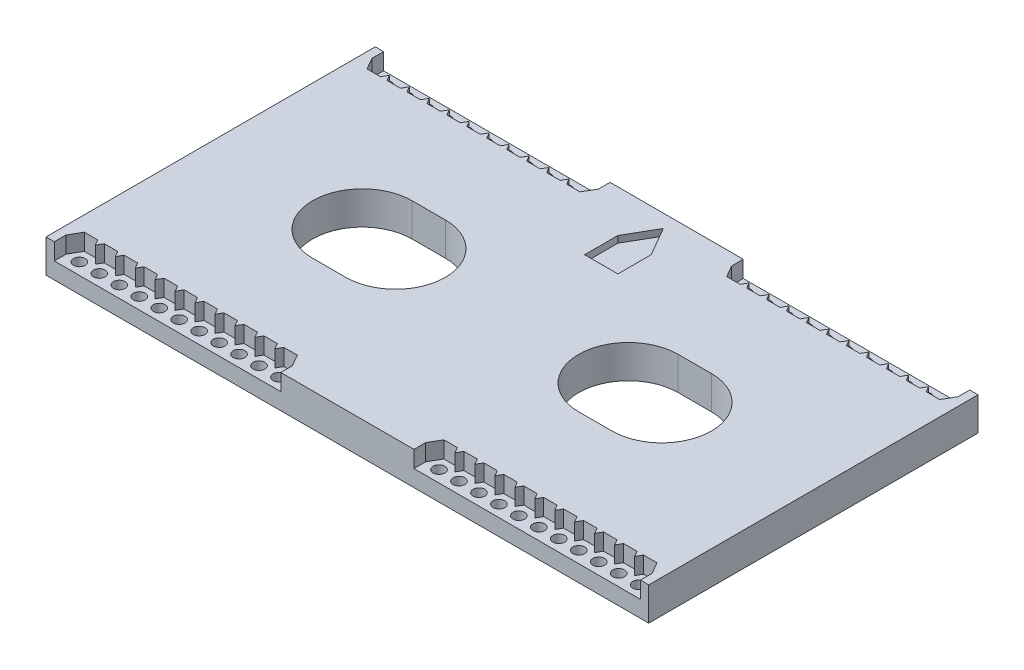
from build123d import *

# Parameters (mm, degrees)
SKETCH1_R           = 2.2479
BOSS_EXTRUDE1_DEPTH = 12.6625
SKETCH1_5_R         = 2.2479
CUT_EXTRUDE1_DEPTH  = 6.35
CUT_EXTRUDE3_DEPTH  = 2.54


with BuildPart() as part:
    # Sketch1 → Boss-Extrude1 (new body)
    with BuildSketch(Plane(origin=(0, 0, 0), x_dir=(1, 0, 0), z_dir=(0, 1, 0))):
        with BuildLine():
            Line((-8.303977719, 62.861825), (-8.303977719, 0))
            Line((-8.303977719, 0), (30.609375, 0))
            ThreePointArc((30.609375, 0), (36.174346157, 13.435028843), (49.609375, 19))
            Line((49.609375, 19), (62.309375, 19))
            ThreePointArc((62.309375, 19), (75.744403843, 13.435028843), (81.309375, 0))
            Line((81.309375, 0), (106.759375, 0))
            Line((106.759375, 0), (106.759375, 62.861825))
            Line((106.759375, 62.861825), (-8.303977719, 62.861825))
        make_face()
        with Locations((0, 58.42)):
            Circle(SKETCH1_R, mode=Mode.SUBTRACT)
        with Locations((7.62, 58.42)):
            Circle(SKETCH1_R, mode=Mode.SUBTRACT)
        with Locations((15.24, 58.42)):
            Circle(SKETCH1_R, mode=Mode.SUBTRACT)
        with Locations((22.86, 58.42)):
            Circle(SKETCH1_R, mode=Mode.SUBTRACT)
        with Locations((30.48, 58.42)):
            Circle(SKETCH1_R, mode=Mode.SUBTRACT)
        with Locations((38.1, 58.42)):
            Circle(SKETCH1_R, mode=Mode.SUBTRACT)
        with Locations((45.72, 58.42)):
            Circle(SKETCH1_R, mode=Mode.SUBTRACT)
        with Locations((53.34, 58.42)):
            Circle(SKETCH1_R, mode=Mode.SUBTRACT)
        with Locations((60.96, 58.42)):
            Circle(SKETCH1_R, mode=Mode.SUBTRACT)
        with Locations((68.58, 58.42)):
            Circle(SKETCH1_R, mode=Mode.SUBTRACT)
        with Locations((76.2, 58.42)):
            Circle(SKETCH1_R, mode=Mode.SUBTRACT)
    extrude(amount=-BOSS_EXTRUDE1_DEPTH)

    # Sketch1<5> → Cut-Extrude1 (cut)
    with BuildSketch(Plane(origin=(0, 0, 0), x_dir=(1, 0, 0), z_dir=(0, 1, 0))):
        Polygon((78.764488859, 53.978175), (80.01, 56.135463577), (81.328977719, 58.42), (81.328977719, 62.861825), (-5.128977719, 62.861825), (-5.128977719, 58.42), (-3.846733289, 56.1990875), (-3.81, 56.135463577), (-2.564488859, 53.978175), (2.564488859, 53.978175), (3.81, 56.135463577), (5.055511141, 53.978175), (10.184488859, 53.978175), (11.43, 56.135463577), (12.675511141, 53.978175), (17.804488859, 53.978175), (19.05, 56.135463577), (20.295511141, 53.978175), (25.424488859, 53.978175), (26.67, 56.135463577), (27.915511141, 53.978175), (33.044488859, 53.978175), (34.29, 56.135463577), (35.535511141, 53.978175), (40.664488859, 53.978175), (41.91, 56.135463577), (43.155511141, 53.978175), (48.284488859, 53.978175), (49.53, 56.135463577), (50.775511141, 53.978175), (55.904488859, 53.978175), (57.15, 56.135463577), (58.395511141, 53.978175), (63.524488859, 53.978175), (64.77, 56.135463577), (66.015511141, 53.978175), (71.144488859, 53.978175), (72.39, 56.135463577), (73.635511141, 53.978175), align=None)
        with Locations((0, 58.42)):
            Circle(SKETCH1_5_R, mode=Mode.SUBTRACT)
        with Locations((7.62, 58.42)):
            Circle(SKETCH1_5_R, mode=Mode.SUBTRACT)
        with Locations((15.24, 58.42)):
            Circle(SKETCH1_5_R, mode=Mode.SUBTRACT)
        with Locations((22.86, 58.42)):
            Circle(SKETCH1_5_R, mode=Mode.SUBTRACT)
        with Locations((30.48, 58.42)):
            Circle(SKETCH1_5_R, mode=Mode.SUBTRACT)
        with Locations((38.1, 58.42)):
            Circle(SKETCH1_5_R, mode=Mode.SUBTRACT)
        with Locations((45.72, 58.42)):
            Circle(SKETCH1_5_R, mode=Mode.SUBTRACT)
        with Locations((53.34, 58.42)):
            Circle(SKETCH1_5_R, mode=Mode.SUBTRACT)
        with Locations((60.96, 58.42)):
            Circle(SKETCH1_5_R, mode=Mode.SUBTRACT)
        with Locations((68.58, 58.42)):
            Circle(SKETCH1_5_R, mode=Mode.SUBTRACT)
        with Locations((76.2, 58.42)):
            Circle(SKETCH1_5_R, mode=Mode.SUBTRACT)
    extrude(amount=-CUT_EXTRUDE1_DEPTH, mode=Mode.SUBTRACT)

    # Mirror1: part across plane


with BuildPart() as part_1:
    add(part.part)
    add(part.part.mirror(Plane.XY))

    # Mirror2: part across plane


with BuildPart() as part_2:
    add(part_1.part)
    add(part_1.part.mirror(Plane(origin=(106.759375, -12.6625, 0), x_dir=(0, 0, 1), z_dir=(-1, 0, 0))))

    # Sketch4 → Cut-Extrude3 (cut)
    with BuildSketch(Plane(origin=(0, 0, 0), x_dir=(1, 0, 0), z_dir=(0, 1, 0))):
        Polygon((106.759375, 57.781825), (100.409375, 46.783302372), (100.409375, 34.083302372), (113.109375, 34.083302372), (113.109375, 46.783302372), align=None)
    extrude(amount=-CUT_EXTRUDE3_DEPTH, mode=Mode.SUBTRACT)


solid = part_2.part
